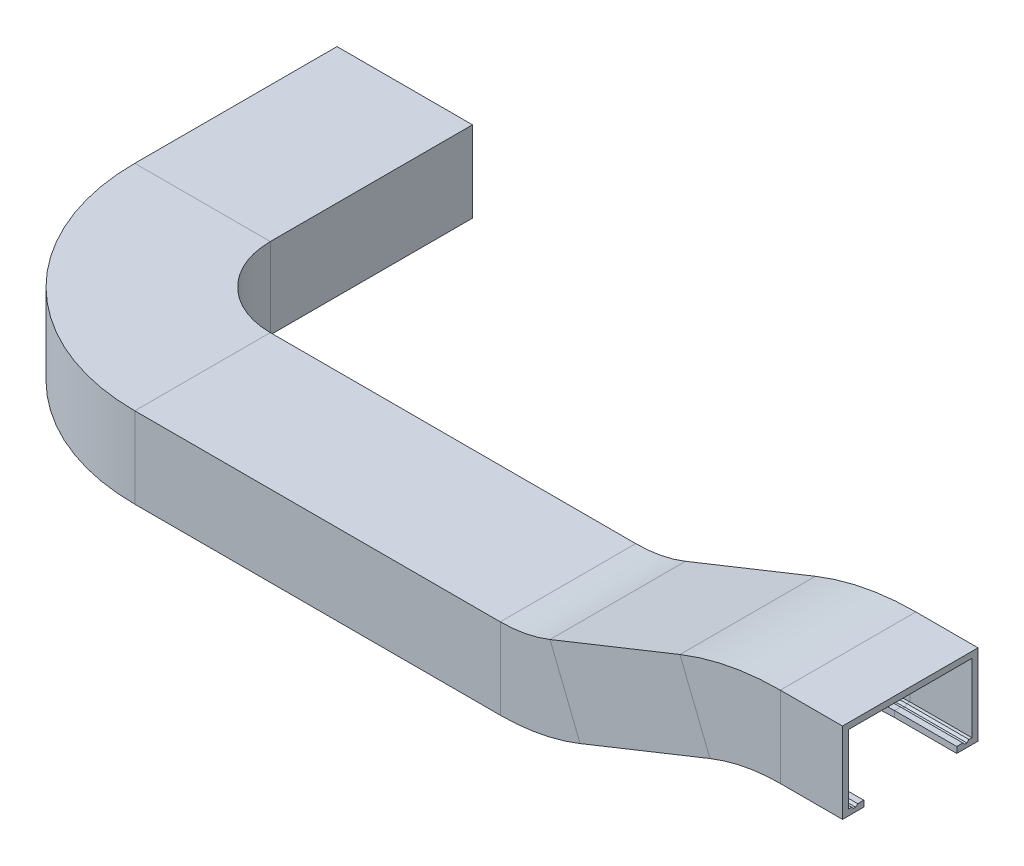
from build123d import *


with BuildPart() as part:
    # Sweep15: sweep along a path in Sketch4
    with BuildLine(Plane(origin=(0, -96.56937012, 0), x_dir=(1, 0, 0), z_dir=(0, 1, 0))) as sweep15_path:
        Line((0, -395.976291919), (-1000, -395.976291919))
        ThreePointArc((-1000, -395.976291919), (-1707.106781187, -103.083073106), (-2000, 604.023708081))
        Line((-2000, 604.023708081), (-2000, 1604.023708081))
    # Sketch3 → Sweep15 (sweep)
    with BuildSketch(Plane(origin=(0, 0, 0), x_dir=(0, 0, -1), z_dir=(1, 0, 0))):
        Polygon((-380.976291919, -129.569370117), (-390.976291919, -139.569370117), (-400.976291919, -139.569370117), (-410.976291919, -129.569370117), (-425.976291919, -129.569370117), (-425.976291919, 210.430629883), (184.023708081, 210.430629883), (184.023708081, -129.569370117), (169.023708081, -129.569370117), (159.023708081, -139.569370117), (149.023708081, -139.569370117), (139.023708081, -129.569370117), (109.023708081, -129.569370117), (109.023708081, -159.569370117), (214.023708081, -159.569370117), (214.023708081, 240.430629883), (-455.976291919, 240.430629883), (-455.976291919, -159.569370117), (-350.976291919, -159.569370117), (-350.976291919, -129.569370117), align=None)
    sweep(path=sweep15_path.line)

    # Sweep18: sweep along a path in Sketch20
    with BuildLine(Plane(origin=(0, 0, 395.976291919), x_dir=(-1, 0, 0), z_dir=(0, 0, -1))) as sweep18_path:
        Line((0, -96.569370117), (-807.417596433, -96.569370117))
        ThreePointArc((-807.417596433, -96.569370117), (-996.525117588, -78.525756848), (-1178.808272787, -25.046061002))
        Line((-1178.808272787, -25.046061002), (-1821.191727213, 231.907320768))
        ThreePointArc((-1821.191727213, 231.907320768), (-2003.474882412, 285.387016615), (-2192.582403567, 303.430629883))
        Line((-2192.582403567, 303.430629883), (-2500, 303.430629883))
    # Sketch3<10> → Sweep18 (sweep)
    with BuildSketch(Plane(origin=(0, 0, 0), x_dir=(0, 0, -1), z_dir=(1, 0, 0))):
        Polygon((-380.976291919, -129.569370117), (-390.976291919, -139.569370117), (-400.976291919, -139.569370117), (-410.976291919, -129.569370117), (-425.976291919, -129.569370117), (-425.976291919, 210.430629883), (184.023708081, 210.430629883), (184.023708081, -129.569370117), (169.023708081, -129.569370117), (159.023708081, -139.569370117), (149.023708081, -139.569370117), (139.023708081, -129.569370117), (109.023708081, -129.569370117), (109.023708081, -159.569370117), (214.023708081, -159.569370117), (214.023708081, 240.430629883), (-455.976291919, 240.430629883), (-455.976291919, -159.569370117), (-350.976291919, -159.569370117), (-350.976291919, -129.569370117), align=None)
    sweep(path=sweep18_path.line)


solid = part.part
